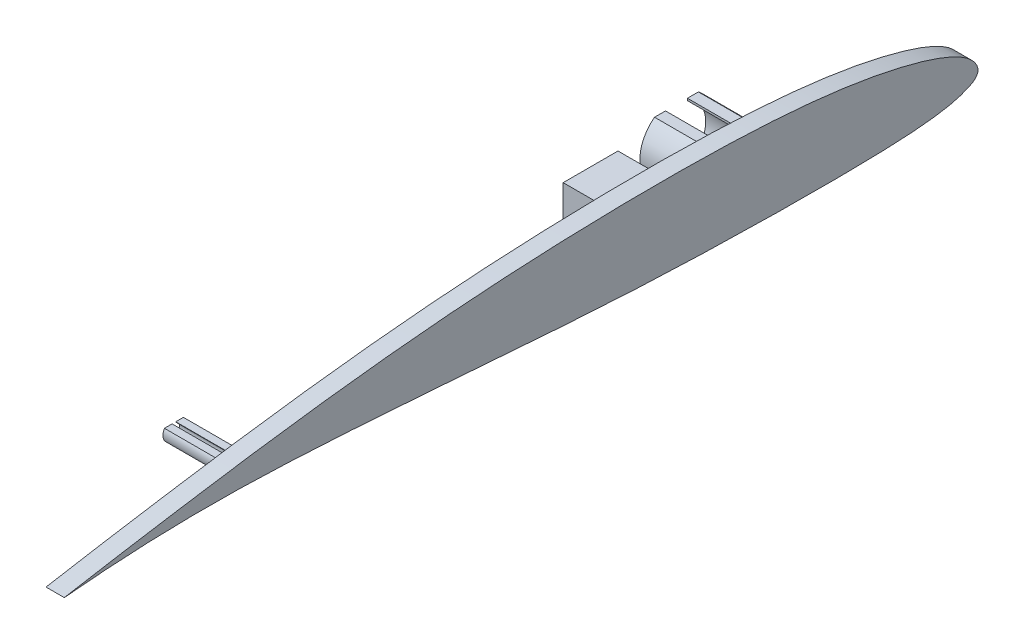
from build123d import *

# Parameters (mm, degrees)
CORPOFOAM_DEPTH              = 5
PERNOAGGANCIOALETTONE_DEPTH  = 20
SCHIZZO4_W                   = 15
SCHIZZO4_H                   = 10
SCHIZZO4_W_2                 = 11
SCHIZZO4_H_2                 = 6
ESTRUSIONE_ESTRUSIONE1_DEPTH = 15


with BuildPart() as part:
    # Schizzo1 → CorpoFoam (new body)
    with BuildSketch(Plane(origin=(0, 0, 0), x_dir=(0, 0, -1), z_dir=(1, 0, 0))):
        with BuildLine():
            add(Edge.make_bspline(
                [(-250, 0), (-250.000228294, -0.008042796), (-248.284955516, 0.172375658), (-246.518112419, 0.308690015), (-242.189387343, 0.685693594), (-236.806461263, 1.074101529), (-229.680385952, 1.49731724), (-221.184158698, 1.823218603), (-211.337618208, 1.967626101), (-200.371188527, 1.833221056), (-188.499913622, 1.38960529), (-175.953687417, 0.706014078), (-162.931424918, -0.160208642), (-149.615771744, -1.148016327), (-136.176354995, -2.19092491), (-122.767140548, -3.219583979), (-109.520053587, -4.152743127), (-96.546095975, -4.938564365), (-83.940819302, -5.536830703), (-71.801839291, -5.947648205), (-60.245256003, -6.218450939), (-49.398732891, -6.355369756), (-39.397226194, -6.381387963), (-30.361934842, -6.26504923), (-22.412181103, -6.012164917), (-15.626227231, -5.597433901), (-10.071907511, -4.928706579), (-5.697692612, -4.040446981), (-2.625320639, -2.865752984), (-0.494884225, -1.71152847), (0.021312549, -0.410454231), (-0.0311692, 0.792659827), (-0.812599242, 2.305684337), (-2.728863517, 4.238352424), (-5.769907241, 6.118172121), (-9.880942804, 7.913594202), (-15.074930468, 9.641318178), (-21.298752222, 11.283896488), (-28.49717212, 12.788381759), (-36.607373406, 14.097834908), (-45.57302844, 15.159429017), (-55.332910074, 15.960903998), (-65.816536498, 16.494069738), (-76.93137626, 16.791989705), (-88.566949028, 16.864754131), (-100.596999886, 16.726715291), (-112.888825982, 16.383385064), (-125.311615819, 15.825573667), (-137.743791097, 15.05233187), (-150.072384382, 14.059339074), (-162.191375056, 12.881586986), (-173.989074322, 11.549280346), (-185.352364446, 10.116249729), (-196.163081698, 8.632379125), (-206.300441402, 7.131513884), (-215.560350587, 5.731221768), (-223.977157043, 4.293295127), (-231.363413336, 3.181808874), (-237.746440904, 2.098942417), (-242.622069366, 1.245861917), (-246.644529332, 0.552864946), (-248.32839844, 0.246216765), (-249.999773563, 0.007977377), (-250, 0)],
                knots=[0, 0, 0, 0, 0.001588889, 0.006329218, 0.014202456, 0.025172808, 0.039173483, 0.056060631, 0.075578924, 0.097363607, 0.120926258, 0.145825281, 0.171670912, 0.198108537, 0.224790184, 0.25139058, 0.277643491, 0.30332675, 0.328257458, 0.352272548, 0.375156062, 0.396620664, 0.416422729, 0.43430442, 0.45005468, 0.463465465, 0.474478994, 0.483169222, 0.489678354, 0.494104066, 0.496910015, 0.497289785, 0.501214273, 0.50645795, 0.513356957, 0.522168632, 0.53296597, 0.545689209, 0.560220779, 0.576438923, 0.594258689, 0.613600245, 0.634342386, 0.656331109, 0.679351894, 0.703152303, 0.727478208, 0.752070739, 0.776691164, 0.801140184, 0.825214387, 0.848697424, 0.871352858, 0.892947449, 0.913230871, 0.931955467, 0.948342069, 0.963693004, 0.976235918, 0.986320059, 0.993788799, 0.998424035, 1, 1, 1, 1], degree=3))
        make_face()
    extrude(amount=CORPOFOAM_DEPTH)

    # Schizzo3 → PernoAggancioAlettone (add)
    with BuildSketch(Plane(origin=(5, 0, 0), x_dir=(0, 0, -1), z_dir=(1, 0, 0))):
        with BuildLine():
            Line((-197.401923789, 6.41748059), (-199.5, 6.41748059))
            Line((-199.5, 6.41748059), (-199.5, 6.331694152))
            ThreePointArc((-199.5, 6.331694152), (-198.5, 4.91748059), (-199.5, 3.503267027))
            Line((-199.5, 3.503267027), (-199.5, 3.41748059))
            Line((-199.5, 3.41748059), (-197.401923789, 3.41748059))
            ThreePointArc((-197.401923789, 3.41748059), (-197, 4.91748059), (-197.401923789, 6.41748059))
        make_face()
        with BuildLine():
            Line((-200.5, 6.41748059), (-200.5, 6.331694152))
            ThreePointArc((-200.5, 6.331694152), (-201.5, 4.91748059), (-200.5, 3.503267027))
            Line((-200.5, 3.503267027), (-200.5, 3.41748059))
            Line((-200.5, 3.41748059), (-202.598076211, 3.41748059))
            ThreePointArc((-202.598076211, 3.41748059), (-203, 4.91748059), (-202.598076211, 6.41748059))
            Line((-202.598076211, 6.41748059), (-200.5, 6.41748059))
        make_face()
    extrude(amount=-PERNOAGGANCIOALETTONE_DEPTH)

    # Schizzo4 → Estrusione-Estrusione1 (add)
    # profile 1 of 3: a face of its own
    with BuildSketch(Plane.ZY):
        with BuildLine():
            Line((56.499919709, 13.077322704), (59.499919709, 13.077322704))
            Line((59.499919709, 13.077322704), (59.499919709, 12.493521191))
            ThreePointArc((59.499919709, 12.493521191), (54.499919709, 5.077322704), (59.499919709, -2.338875783))
            Line((59.499919709, -2.338875783), (59.499919709, -2.922677296))
            Line((59.499919709, -2.922677296), (56.499919709, -2.922677296))
            ThreePointArc((56.499919709, -2.922677296), (52.499919709, 5.077322704), (56.499919709, 13.077322704))
        make_face()
    # profile 2 of 3: a face of its own
    with BuildSketch(Plane.ZY):
        with Locations((85.999919709, 5.077322704)):
            Rectangle(SCHIZZO4_W, SCHIZZO4_H)
        with Locations((85.999919709, 5.077322704)):
            Rectangle(SCHIZZO4_W_2, SCHIZZO4_H_2, mode=Mode.SUBTRACT)
    # profile 3 of 3: a face of its own
    with BuildSketch(Plane.ZY):
        with BuildLine():
            Line((65.499919709, 13.077322704), (65.499919709, 12.493521191))
            ThreePointArc((65.499919709, 12.493521191), (70.499919709, 5.077322704), (65.499919709, -2.338875783))
            Line((65.499919709, -2.338875783), (65.499919709, -2.922677296))
            Line((65.499919709, -2.922677296), (68.499919709, -2.922677296))
            ThreePointArc((68.499919709, -2.922677296), (72.499919709, 5.077322704), (68.499919709, 13.077322704))
            Line((68.499919709, 13.077322704), (65.499919709, 13.077322704))
        make_face()
    extrude(amount=ESTRUSIONE_ESTRUSIONE1_DEPTH)


solid = part.part
